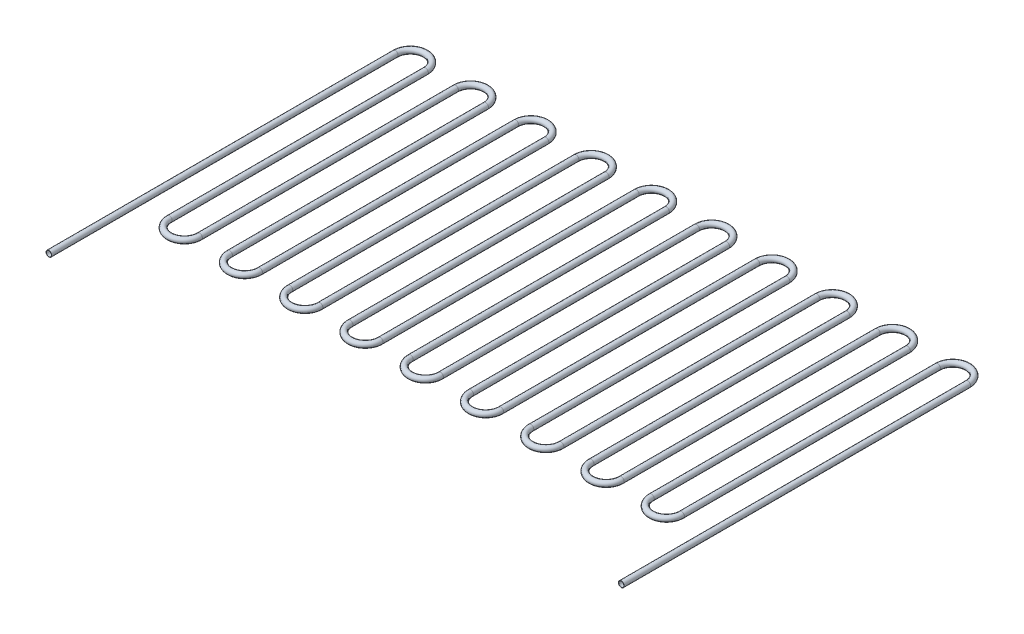
from build123d import *

# Parameters (mm, degrees)
SWEEP_THIN1_PROFILE_R   = 9.525
SWEEP_THIN1_PROFILE_R_2 = 8.525


with BuildPart() as part:
    # Sweep-Thin1: sweep along a path in Sketch4
    with BuildLine(Plane(origin=(0, 0, 0), x_dir=(1, 0, 0), z_dir=(0, 1, 0))) as sweep_thin1_path:
        Line((-971.811497652, -746.135539322), (-971.811497652, -446.135539322))
        Line((-971.811497652, -446.135539322), (-971.811497652, 403.864460678))
        ThreePointArc((-971.811497652, 403.864460678), (-921.811497652, 453.864460678), (-871.811497652, 403.864460678))
        Line((-871.811497652, 403.864460678), (-871.811497652, -446.135539322))
        ThreePointArc((-871.811497652, -446.135539322), (-821.811497652, -496.135539322), (-771.811497652, -446.135539322))
        Line((-771.811497652, -446.135539322), (-771.811497652, 403.864460678))
        ThreePointArc((-771.811497652, 403.864460678), (-721.811497652, 453.864460678), (-671.811497652, 403.864460678))
        Line((-671.811497652, 403.864460678), (-671.811497652, -446.135539322))
        ThreePointArc((-671.811497652, -446.135539322), (-621.811497652, -496.135539322), (-571.811497652, -446.135539322))
        Line((-571.811497652, -446.135539322), (-571.811497652, 403.864460678))
        ThreePointArc((-571.811497652, 403.864460678), (-521.811497652, 453.864460678), (-471.811497652, 403.864460678))
        Line((-471.811497652, 403.864460678), (-471.811497652, -446.135539322))
        ThreePointArc((-471.811497652, -446.135539322), (-421.811497652, -496.135539322), (-371.811497652, -446.135539322))
        Line((-371.811497652, -446.135539322), (-371.811497652, 403.864460678))
        ThreePointArc((-371.811497652, 403.864460678), (-321.811497652, 453.864460678), (-271.811497652, 403.864460678))
        Line((-271.811497652, 403.864460678), (-271.811497652, -446.135539322))
        ThreePointArc((-271.811497652, -446.135539322), (-221.811497652, -496.135539322), (-171.811497652, -446.135539322))
        Line((-171.811497652, -446.135539322), (-171.811497652, 403.864460678))
        ThreePointArc((-171.811497652, 403.864460678), (-121.811497652, 453.864460678), (-71.811497652, 403.864460678))
        Line((-71.811497652, 403.864460678), (-71.811497652, -446.135539322))
        ThreePointArc((-71.811497652, -446.135539322), (-21.811497652, -496.135539322), (28.188502348, -446.135539322))
        Line((28.188502348, -446.135539322), (28.188502348, 403.864460678))
        ThreePointArc((28.188502348, 403.864460678), (78.188502348, 453.864460678), (128.188502348, 403.864460678))
        Line((128.188502348, 403.864460678), (128.188502348, -446.135539322))
        ThreePointArc((128.188502348, -446.135539322), (178.188502348, -496.135539322), (228.188502348, -446.135539322))
        Line((228.188502348, -446.135539322), (228.188502348, 403.864460678))
        ThreePointArc((228.188502348, 403.864460678), (278.188502348, 453.864460678), (328.188502348, 403.864460678))
        Line((328.188502348, 403.864460678), (328.188502348, -446.135539322))
        ThreePointArc((328.188502348, -446.135539322), (378.188502347, -496.135539322), (428.188502347, -446.135539322))
        Line((428.188502347, -446.135539322), (428.188502347, 403.864460678))
        ThreePointArc((428.188502347, 403.864460678), (478.188502347, 453.864460678), (528.188502347, 403.864460678))
        Line((528.188502347, 403.864460678), (528.188502347, -446.135539322))
        ThreePointArc((528.188502347, -446.135539322), (578.188502347, -496.135539322), (628.188502347, -446.135539322))
        Line((628.188502347, -446.135539322), (628.188502347, 403.864460678))
        ThreePointArc((628.188502347, 403.864460678), (678.188502347, 453.864460678), (728.188502347, 403.864460678))
        Line((728.188502347, 403.864460678), (728.188502347, -446.135539322))
        ThreePointArc((728.188502347, -446.135539322), (778.188502347, -496.135539322), (828.188502347, -446.135539322))
        Line((828.188502347, -446.135539322), (828.188502347, 403.864460678))
        ThreePointArc((828.188502347, 403.864460678), (878.188502347, 453.864460678), (928.188502347, 403.864460678))
        Line((928.188502347, 403.864460678), (928.188502347, -446.135539322))
        Line((928.188502347, -446.135539322), (928.188502347, -746.135539322))
    # Sweep-Thin1 profile (on start of the path) → Sweep-Thin1 (sweep)
    with BuildSketch(Plane(origin=(-971.811497652, 0, 746.135539322), x_dir=(-1, 0, 0), z_dir=(0, 0, -1))):
        Circle(SWEEP_THIN1_PROFILE_R)
        Circle(SWEEP_THIN1_PROFILE_R_2, mode=Mode.SUBTRACT)
    sweep(path=sweep_thin1_path.line)


solid = part.part
